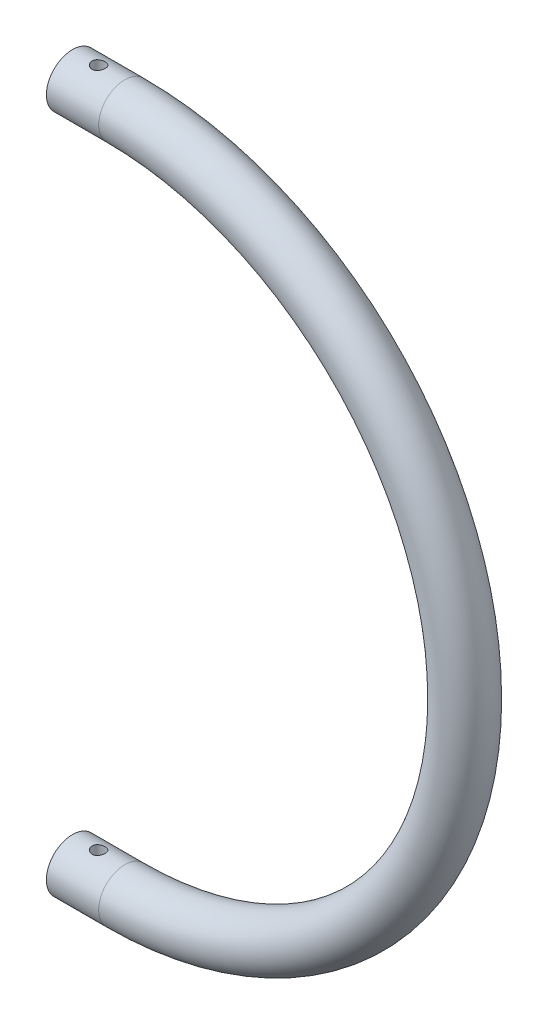
from build123d import *

# Parameters (mm, degrees)
BALAYAGE2_PROFILE_R          = 10
ESQUISSE38_R                 = 10
BOSS_EXTRU_1_DEPTH           = 20
ESQUISSE39_R                 = 10
BOSS_EXTRU_2_DEPTH           = 20
ENL_V_MAT_EXTRU_1_DEPTH      = 199.242276162
ENL_V_MAT_EXTRU_1_DEPTH_BACK = 199.242276162
ESQUISSE41_R                 = 2.5


with BuildPart() as part:
    # Balayage2: sweep along a path in Esquisse2
    with BuildLine(Plane.XY) as balayage2_path:
        ThreePointArc((0, -130), (130, 0), (0, 130))
    # Balayage2 profile (on start of the path) → Balayage2 (sweep)
    with BuildSketch(Plane(origin=(0, -130, 0), x_dir=(0, 1, 0), z_dir=(1, 0, 0))):
        Circle(BALAYAGE2_PROFILE_R)
    sweep(path=balayage2_path.line)

    # Esquisse38 → Boss.-Extru.1 (add)
    with BuildSketch(Plane.ZY):
        with Locations(Location((0, -130, 0), (0, 0, 90))):
            Circle(ESQUISSE38_R)
    extrude(amount=BOSS_EXTRU_1_DEPTH)

    # Esquisse39 → Boss.-Extru.2 (add)
    with BuildSketch(Plane.ZY):
        with Locations(Location((0, 130, 0), (0, 0, 90))):
            Circle(ESQUISSE39_R)
    extrude(amount=BOSS_EXTRU_2_DEPTH)

    # Esquisse41 → Enlèv. mat.-Extru.1 (cut, two sides: drawn at the far end of the back side and taken through both)
    with BuildSketch(Plane(origin=(0, 0, 0), x_dir=(1, 0, 0), z_dir=(0, 1, 0)).offset(-ENL_V_MAT_EXTRU_1_DEPTH_BACK)):
        with Locations(Location((-10, 0, 0), (0, 0, 270))):
            Circle(ESQUISSE41_R)
    extrude(amount=ENL_V_MAT_EXTRU_1_DEPTH + ENL_V_MAT_EXTRU_1_DEPTH_BACK, mode=Mode.SUBTRACT)


solid = part.part
